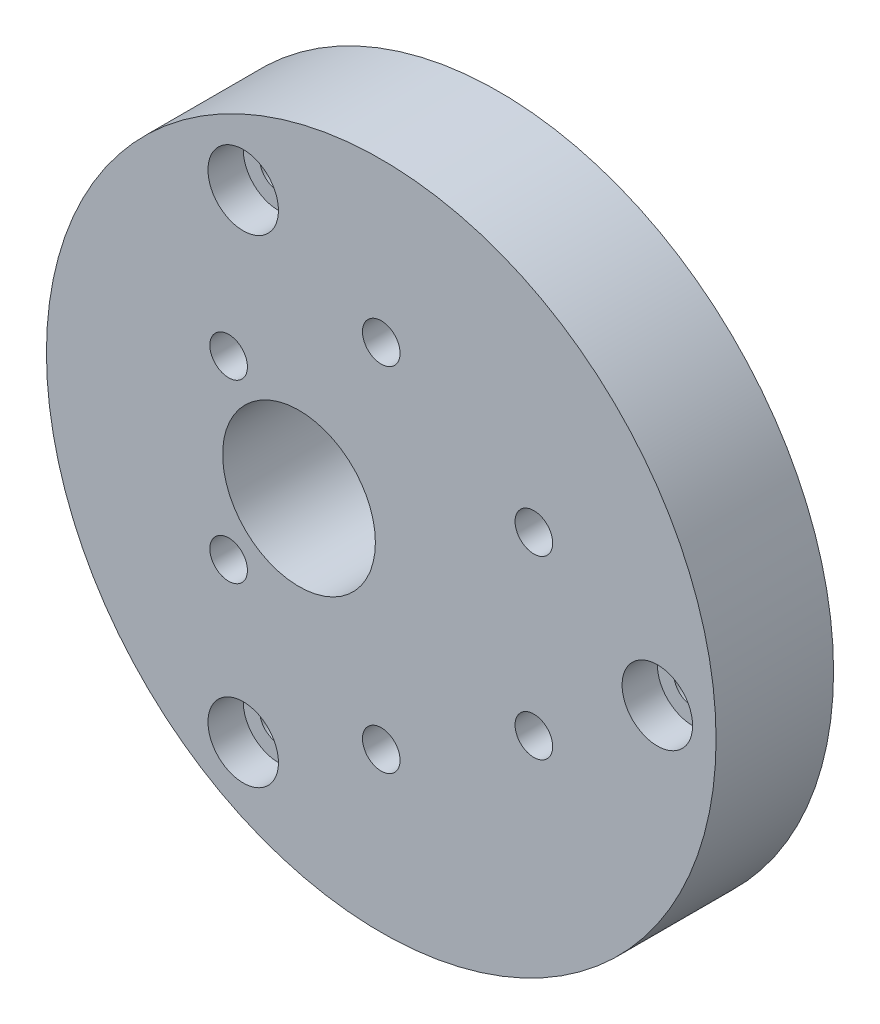
from build123d import *

# Parameters (mm, degrees)
CROQUIS1_R              = 28.5
CROQUIS1_R_2            = 6.5
SALIENTE_EXTRUIR1_DEPTH = 10
MATRIZC2_COUNT          = 3
MATRIZC3_COUNT          = 6


with BuildPart() as part:
    # Croquis1 → Saliente-Extruir1 (new body)
    with BuildSketch(Plane.XY):
        Circle(CROQUIS1_R)
        with Locations((-7, 0)):
            Circle(CROQUIS1_R_2, mode=Mode.SUBTRACT)
    extrude(amount=SALIENTE_EXTRUIR1_DEPTH)

    # Croquis4 → Refrentado para tornillo con cabeza tron (revolve, cut)
    with BuildSketch(Plane(origin=(23.5, 0, 10), x_dir=(0, -1, 0), z_dir=(1, 0, 0))):
        Polygon((0, 0), (0, 20.96137699), (1.6, 20), (1.6, 3), (3, 3), (3, 0), align=None)
    refrentado_para_tornillo_con_cabeza_tron = revolve(axis=Axis((23.5, 0, 16.35), (0, 0, -1)), mode=Mode.SUBTRACT)

    # MatrizC2: Refrentado para tornillo con cabeza tron ×3 about axis
    matrizc2_axis = Axis((0, 0, 0), (0, 0, 1))
    for i in range(1, MATRIZC2_COUNT):
        add(refrentado_para_tornillo_con_cabeza_tron.rotate(matrizc2_axis, i * 360 / MATRIZC2_COUNT), mode=Mode.SUBTRACT)

    # Croquis9 → Refrentado para tornillo con cabeza  2 (revolve, cut)
    with BuildSketch(Plane(origin=(12.990381057, 7.5, 0), x_dir=(0, 1, 0), z_dir=(1, 0, 0))):
        Polygon((0, 0), (0, 20.96137699), (1.6, 20), (1.6, 3), (3, 3), (3, 0), align=None)
    refrentado_para_tornillo_con_cabeza_2 = revolve(axis=Axis((12.990381057, 7.5, -6.35), (0, 0, 1)), mode=Mode.SUBTRACT)

    # MatrizC3: Refrentado para tornillo con cabeza  2 ×6 about axis
    matrizc3_axis = Axis((0, 0, 0), (0, 0, 1))
    for i in range(1, MATRIZC3_COUNT):
        add(refrentado_para_tornillo_con_cabeza_2.rotate(matrizc3_axis, i * 360 / MATRIZC3_COUNT), mode=Mode.SUBTRACT)


solid = part.part
